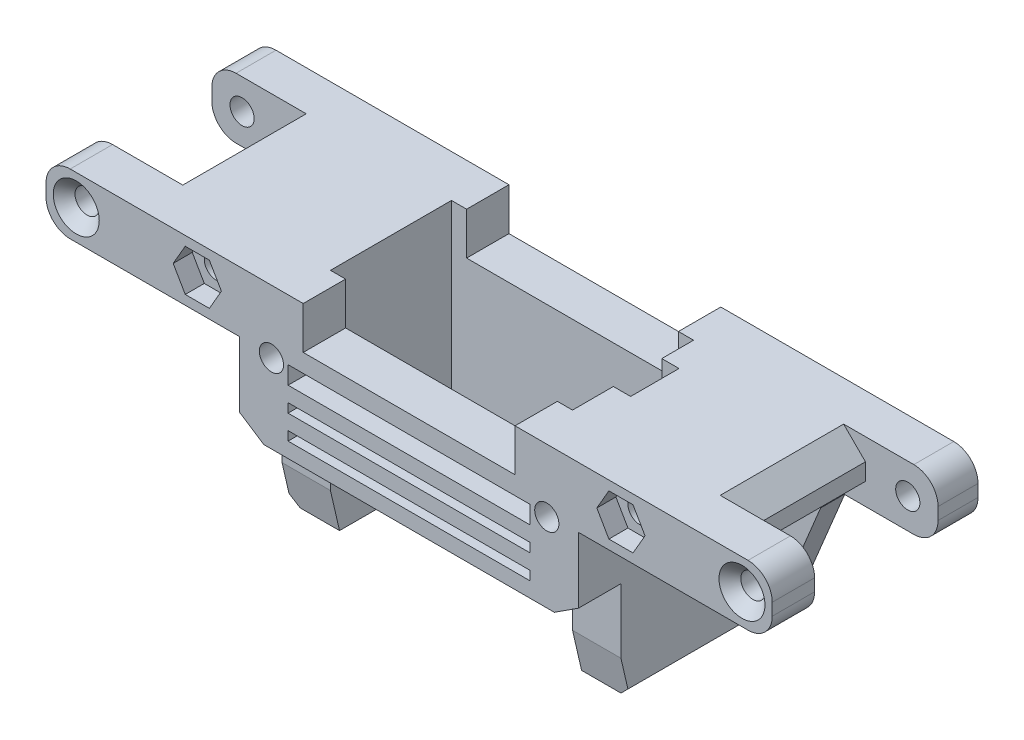
from build123d import *

# Parameters (mm, degrees)
BOSS_EXTRUDE1_DEPTH                             = 10
CSK_FOR_M4_FLAT_HEAD_MACHINE_SCREW1_D           = 4
CSK_FOR_M4_FLAT_HEAD_MACHINE_SCREW1_DEPTH       = 53.798278762
CSK_FOR_M4_FLAT_HEAD_MACHINE_SCREW1_CSINK_D     = 7.6
CSK_FOR_M4_FLAT_HEAD_MACHINE_SCREW1_CSINK_ANGLE = 90
CSK_FOR_M4_FLAT_HEAD_MACHINE_SCREW1_TIP         = 1.201721238
FILLET1_R                                       = 4
BOSS_EXTRUDE2_DEPTH                             = 28
SKETCH6_W                                       = 40
SKETCH6_H                                       = 1.5
SKETCH6_H_2                                     = 2
BOSS_EXTRUDE3_DEPTH                             = 7
SKETCH7_W                                       = 20
SKETCH7_H                                       = 10
BOSS_EXTRUDE4_DEPTH                             = 20
CHAMFER1_SIZE                                   = 3.6
BOSS_EXTRUDE5_START                             = 10
SKETCH9_W                                       = 4
SKETCH9_H                                       = 28
BOSS_EXTRUDE5_DEPTH                             = 76
CHAMFER2_SIZE                                   = 11.5
SKETCH10_W                                      = 56
SKETCH10_H                                      = 7
CUT_EXTRUDE1_DEPTH                              = 14.56
CHAMFER3_SIZE                                   = 1.5
CHAMFER3_SIZE2                                  = 6.497213811
CSK_FOR_M4_FLAT_HEAD_MACHINE_SCREW2_D           = 4
CSK_FOR_M4_FLAT_HEAD_MACHINE_SCREW2_DEPTH       = 38.798278762
CSK_FOR_M4_FLAT_HEAD_MACHINE_SCREW2_CSINK_D     = 7.9
CSK_FOR_M4_FLAT_HEAD_MACHINE_SCREW2_CSINK_ANGLE = 90
CSK_FOR_M4_FLAT_HEAD_MACHINE_SCREW2_TIP         = 1.201721238
CUT_EXTRUDE2_DEPTH                              = 3.15
F_1_0MM_DOWEL_HOLE1_D                           = 3
F_1_0MM_DOWEL_HOLE1_DEPTH                       = 12.598709071
F_1_0MM_DOWEL_HOLE1_TIP                         = 0.901290929
CHAMFER4_SIZE                                   = 10
CUT_EXTRUDE3_DEPTH                              = 3.15
SKETCH17_W                                      = 5.7
SKETCH17_H                                      = 8
CUT_EXTRUDE4_DEPTH                              = 42
CUT_EXTRUDE5_DEPTH                              = 75.431176264
CUT_EXTRUDE5_DEPTH_BACK                         = 75.431176264
SKETCH18_W                                      = 35
SKETCH18_H                                      = 14
CUT_EXTRUDE6_DEPTH                              = 15
CSK_FOR_M4_SFHCS2_D                             = 4
CSK_FOR_M4_SFHCS2_DEPTH                         = 11
CSK_FOR_M4_SFHCS2_CSINK_D                       = 7.6
CSK_FOR_M4_SFHCS2_CSINK_ANGLE                   = 90
CSK_FOR_M4_SFHCS2_TIP                           = 1.201721238
CSK_FOR_M4_SFHCS3_D                             = 4
CSK_FOR_M4_SFHCS3_DEPTH                         = 16
CSK_FOR_M4_SFHCS3_CSINK_D                       = 7.9
CSK_FOR_M4_SFHCS3_CSINK_ANGLE                   = 90
CSK_FOR_M4_SFHCS3_TIP                           = 1.201721238
CUT_EXTRUDE7_DEPTH                              = 0.4


with BuildPart() as part:
    # Sketch1 → Boss-Extrude1 (new body)
    with BuildSketch(Plane(origin=(0, 0, 0), x_dir=(1, 0, 0), z_dir=(0, 1, 0))):
        Polygon((60, 17), (-60, 17), (-60, 10), (-28, 10), (-28, 0), (-20, 0), (-20, 10), (20, 10), (20, 0), (28, 0), (28, 10), (60, 10), align=None)
        Polygon((-20, 0), (-28, 0), (-28, -10), (-60, -10), (-60, -17), (60, -17), (60, -10), (28, -10), (28, 0), (20, 0), (20, -10), (-20, -10), align=None)
    extrude(amount=BOSS_EXTRUDE1_DEPTH)

    # CSK for M4 Flat Head Machine Screw1
    with Locations(Plane.XY.offset(17)):
        with Locations((-55, 5), (55, 5)):
            CounterSinkHole(CSK_FOR_M4_FLAT_HEAD_MACHINE_SCREW1_D / 2, CSK_FOR_M4_FLAT_HEAD_MACHINE_SCREW1_CSINK_D / 2, depth=CSK_FOR_M4_FLAT_HEAD_MACHINE_SCREW1_DEPTH, counter_sink_angle=CSK_FOR_M4_FLAT_HEAD_MACHINE_SCREW1_CSINK_ANGLE)
            with Locations((0, 0, -(CSK_FOR_M4_FLAT_HEAD_MACHINE_SCREW1_DEPTH + CSK_FOR_M4_FLAT_HEAD_MACHINE_SCREW1_TIP / 2))):  # 118° drill point
                Cone(0, CSK_FOR_M4_FLAT_HEAD_MACHINE_SCREW1_D / 2, CSK_FOR_M4_FLAT_HEAD_MACHINE_SCREW1_TIP, mode=Mode.SUBTRACT)

    # Fillet1
    fillet1_edges = [part.edges().sort_by_distance(p)[0] for p in [
        (60, 0, 13.5),
        (-60, 0, 13.5),
        (-60, 0, -13.5),
        (60, 0, -13.5),
        (60, 10, -13.5),
        (-60, 10, -13.5),
        (-60, 10, 13.5),
        (60, 10, 13.5),
    ]]
    fillet(fillet1_edges, radius=FILLET1_R)

    # Sketch5 → Boss-Extrude2 (add)
    with BuildSketch(Plane.XZ):
        Polygon((-28, 10), (-28, -17), (28, -17), (28, 10), (20, 10), (20, -10), (-20, -10), (-20, 10), align=None)
    extrude(amount=BOSS_EXTRUDE2_DEPTH)

    # Sketch6 → Boss-Extrude3 (add)
    with BuildSketch(Plane.XY.offset(10)):
        Polygon((-28, 0), (-28, -28), (28, -28), (28, 0), (20, 0), (20, -2.94), (-20, -2.94), (-20, 0), align=None)
        with Locations((0, -6.19)):
            Rectangle(SKETCH6_W, SKETCH6_H, mode=Mode.SUBTRACT)
        with Locations((0, -10.19)):
            Rectangle(SKETCH6_W, SKETCH6_H, mode=Mode.SUBTRACT)
        with Locations((0, -14.19)):
            Rectangle(SKETCH6_W, SKETCH6_H, mode=Mode.SUBTRACT)
        with Locations((0, -18.19)):
            Rectangle(SKETCH6_W, SKETCH6_H, mode=Mode.SUBTRACT)
        with Locations((0, -22.44)):
            Rectangle(SKETCH6_W, SKETCH6_H_2, mode=Mode.SUBTRACT)
    extrude(amount=BOSS_EXTRUDE3_DEPTH)

    # Sketch7 → Boss-Extrude4 (add)
    with BuildSketch(Plane.XY.offset(-10)):
        with Locations((38, 5)):
            Rectangle(SKETCH7_W, SKETCH7_H)
        with Locations((-38, 5)):
            Rectangle(SKETCH7_W, SKETCH7_H)
    extrude(amount=BOSS_EXTRUDE4_DEPTH)

    # Chamfer1
    chamfer1_edges = [part.edges().sort_by_distance(p)[0] for p in [
        (48, 10, 0),
        (48, 0, 0),
        (-48, 0, 0),
        (-48, 10, 0),
    ]]
    chamfer(chamfer1_edges, length=CHAMFER1_SIZE)

    # Sketch9 → Boss-Extrude5 (add)
    with BuildSketch(Plane.ZY.offset(28).offset(BOSS_EXTRUDE5_START)):
        with Locations((-15, -14)):
            Rectangle(SKETCH9_W, SKETCH9_H)
    extrude(amount=-BOSS_EXTRUDE5_DEPTH)

    # Chamfer2
    chamfer2_edges = [part.edges().sort_by_distance(p)[0] for p in [
        (38, -28, -15),
        (-38, -28, -15),
    ]]
    chamfer(chamfer2_edges, length=CHAMFER2_SIZE)

    # Sketch10 → Cut-Extrude1 (cut)
    with BuildSketch(Plane.XZ.offset(28)):
        with Locations((0, 13.5)):
            Rectangle(SKETCH10_W, SKETCH10_H)
    extrude(amount=-CUT_EXTRUDE1_DEPTH, mode=Mode.SUBTRACT)

    # Chamfer3
    chamfer3_edges = [part.edges().sort_by_distance(p)[0] for p in [
        (23.25, -28, 10),
        (-23.25, -28, 10),
    ]]
    chamfer3_side = [part.faces().sort_by_distance(p)[0] for p in [
        (0, -28, -16.405189106),
    ]]
    chamfer(chamfer3_edges, length=CHAMFER3_SIZE, length2=CHAMFER3_SIZE2, reference=chamfer3_side[0])

    # CSK for M4 Flat Head Machine Screw2
    with Locations(Plane(origin=(-695.683007616, 1385.247292614, -21), x_dir=(-1, 0, 0), z_dir=(0, 0, -1))):
        with Locations((-730.683007616, -1380.247292614), (-660.683007616, -1380.247292614)):
            CounterSinkHole(CSK_FOR_M4_FLAT_HEAD_MACHINE_SCREW2_D / 2, CSK_FOR_M4_FLAT_HEAD_MACHINE_SCREW2_CSINK_D / 2, depth=CSK_FOR_M4_FLAT_HEAD_MACHINE_SCREW2_DEPTH, counter_sink_angle=CSK_FOR_M4_FLAT_HEAD_MACHINE_SCREW2_CSINK_ANGLE)
            with Locations((0, 0, -(CSK_FOR_M4_FLAT_HEAD_MACHINE_SCREW2_DEPTH + CSK_FOR_M4_FLAT_HEAD_MACHINE_SCREW2_TIP / 2))):  # 118° drill point
                Cone(0, CSK_FOR_M4_FLAT_HEAD_MACHINE_SCREW2_D / 2, CSK_FOR_M4_FLAT_HEAD_MACHINE_SCREW2_TIP, mode=Mode.SUBTRACT)

    # Sketch13 → Cut-Extrude2 (cut)
    with BuildSketch(Plane.XY.offset(17)):
        Polygon((-31.016283143, 5), (-33.008141571, 8.45), (-36.991858429, 8.45), (-38.983716857, 5), (-36.991858429, 1.55), (-33.008141571, 1.55), align=None)
        Polygon((38.983716857, 5), (36.991858429, 8.45), (33.008141571, 8.45), (31.016283143, 5), (33.008141571, 1.55), (36.991858429, 1.55), align=None)
    extrude(amount=-CUT_EXTRUDE2_DEPTH, mode=Mode.SUBTRACT)

    # Ø1.0mm Dowel Hole1
    with Locations(Plane(origin=(0, -28, 0), x_dir=(-1, 0, 0), z_dir=(0, -1, 0))):
        with Locations((-24.134952034, 4.858), (-24.134952034, -5.048), (24.015, -5.048), (24.015, 4.858)):
            Hole(F_1_0MM_DOWEL_HOLE1_D / 2, depth=F_1_0MM_DOWEL_HOLE1_DEPTH)
            with Locations((0, 0, -(F_1_0MM_DOWEL_HOLE1_DEPTH + F_1_0MM_DOWEL_HOLE1_TIP / 2))):  # 118° drill point
                Cone(0, F_1_0MM_DOWEL_HOLE1_D / 2, F_1_0MM_DOWEL_HOLE1_TIP, mode=Mode.SUBTRACT)

    # Chamfer4
    chamfer4_edges = [part.edges().sort_by_distance(p)[0] for p in [
        (38, -16.5, -15),
        (-38, -16.5, -15),
    ]]
    chamfer(chamfer4_edges, length=CHAMFER4_SIZE)

    # Sketch16 → Cut-Extrude3 (cut)
    with BuildSketch(Plane(origin=(0, 0, -17), x_dir=(-1, 0, 0), z_dir=(0, 0, -1))):
        Polygon((51.016283143, 5), (53.008141571, 1.55), (56.991858429, 1.55), (58.983716857, 5), (56.991858429, 8.45), (53.008141571, 8.45), align=None)
        Polygon((-51.016283143, 5), (-53.008141571, 8.45), (-56.991858429, 8.45), (-58.983716857, 5), (-56.991858429, 1.55), (-53.008141571, 1.55), align=None)
    extrude(amount=-CUT_EXTRUDE3_DEPTH, mode=Mode.SUBTRACT)

    # Sketch17 → Cut-Extrude4 (cut)
    with BuildSketch(Plane.XZ.offset(28)):
        with Locations((20, -0.75)):
            Rectangle(SKETCH17_W, SKETCH17_H)
    extrude(amount=-CUT_EXTRUDE4_DEPTH, mode=Mode.SUBTRACT)

    # Sketch18 → Cut-Extrude5 (cut, two sides: drawn at the far end of the back side and taken through both)
    with BuildSketch(Plane.XY.offset(17).offset(-CUT_EXTRUDE5_DEPTH_BACK)):
        with Locations((0, 10)):
            Rectangle(SKETCH18_W, SKETCH18_H)
    extrude(amount=CUT_EXTRUDE5_DEPTH + CUT_EXTRUDE5_DEPTH_BACK, mode=Mode.SUBTRACT)

    # Sketch19 → Cut-Extrude6 (cut)
    with BuildSketch(Plane(origin=(-695.683007616, 1385.247292614, 25), x_dir=(1, 0, 0), z_dir=(0, 0, 1))):
        Polygon((667.683007616, -1396.089662241), (667.683007616, -1398.687292614), (671.683007616, -1398.687292614), align=None)
        Polygon((719.683007616, -1398.687292614), (723.683007616, -1398.687292614), (723.683007616, -1396.089662241), align=None)
    extrude(amount=-CUT_EXTRUDE6_DEPTH, mode=Mode.SUBTRACT)

    # CSK for M4 SFHCS2
    with Locations(Plane(origin=(-695.683007616, 1385.247292614, -10), x_dir=(1, 0, 0), z_dir=(0, 0, 1))):
        with Locations((681.183007616, -1407.747292614), (710.183007616, -1407.747292614)):
            CounterSinkHole(CSK_FOR_M4_SFHCS2_D / 2, CSK_FOR_M4_SFHCS2_CSINK_D / 2, depth=CSK_FOR_M4_SFHCS2_DEPTH, counter_sink_angle=CSK_FOR_M4_SFHCS2_CSINK_ANGLE)
            with Locations((0, 0, -(CSK_FOR_M4_SFHCS2_DEPTH + CSK_FOR_M4_SFHCS2_TIP / 2))):  # 118° drill point
                Cone(0, CSK_FOR_M4_SFHCS2_D / 2, CSK_FOR_M4_SFHCS2_TIP, mode=Mode.SUBTRACT)

    # CSK for M4 SFHCS3
    with Locations(Plane(origin=(-695.683007616, 1385.247292614, 25), x_dir=(1, 0, 0), z_dir=(0, 0, 1))):
        with Locations((672.933007616, -1385.668477427), (718.433007616, -1385.668477427)):
            CounterSinkHole(CSK_FOR_M4_SFHCS3_D / 2, CSK_FOR_M4_SFHCS3_CSINK_D / 2, depth=CSK_FOR_M4_SFHCS3_DEPTH, counter_sink_angle=CSK_FOR_M4_SFHCS3_CSINK_ANGLE)
            with Locations((0, 0, -(CSK_FOR_M4_SFHCS3_DEPTH + CSK_FOR_M4_SFHCS3_TIP / 2))):  # 118° drill point
                Cone(0, CSK_FOR_M4_SFHCS3_D / 2, CSK_FOR_M4_SFHCS3_TIP, mode=Mode.SUBTRACT)

    # Sketch26 → Cut-Extrude7 (cut)
    with BuildSketch(Plane.XY.offset(-10)):
        with BuildLine():
            Line((-48, 3.6), (-48, 6.4))
            Line((-48, 6.4), (-44.4, 10))
            Line((-44.4, 10), (-56, 10))
            ThreePointArc((-56, 10), (-58.828427125, 8.828427125), (-60, 6))
            Line((-60, 6), (-60, 4))
            ThreePointArc((-60, 4), (-58.828427125, 1.171572875), (-56, 0))
            Line((-56, 0), (-44.4, 0))
            Line((-44.4, 0), (-48, 3.6))
        make_face()
        with BuildLine():
            Line((48, 6.4), (48, 3.6))
            Line((48, 3.6), (44.4, 0))
            Line((44.4, 0), (56, 0))
            ThreePointArc((56, 0), (58.828427125, 1.171572875), (60, 4))
            Line((60, 4), (60, 6))
            ThreePointArc((60, 6), (58.828427125, 8.828427125), (56, 10))
            Line((56, 10), (44.4, 10))
            Line((44.4, 10), (48, 6.4))
        make_face()
    extrude(amount=-CUT_EXTRUDE7_DEPTH, mode=Mode.SUBTRACT)


solid = part.part
